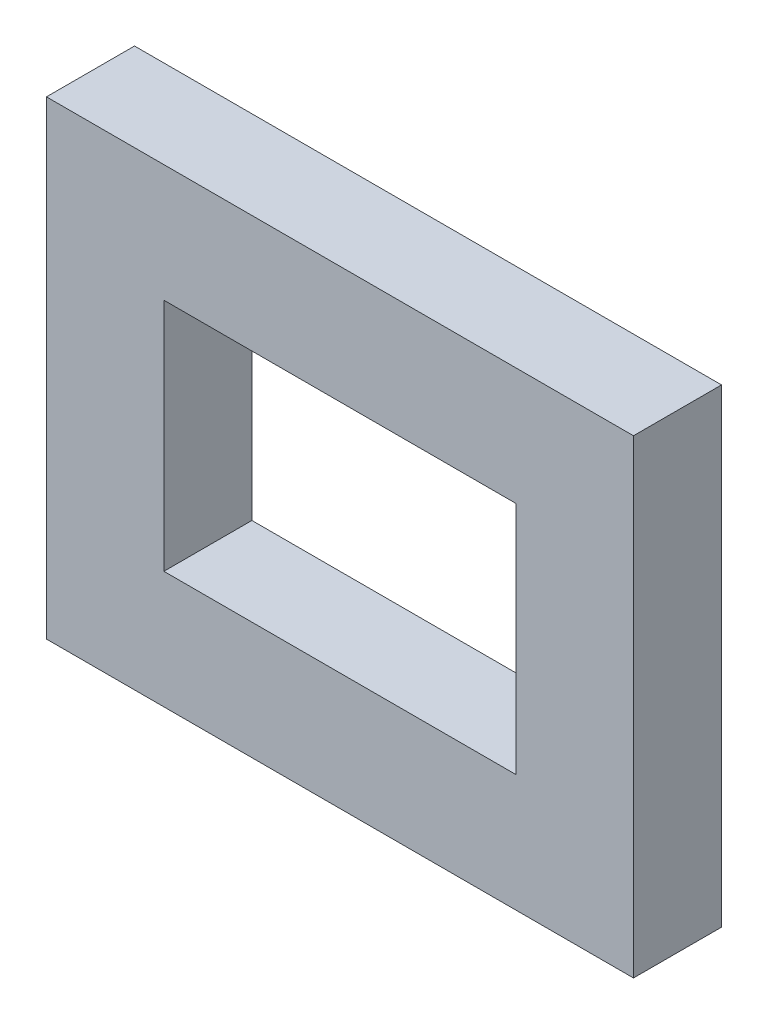
from build123d import *

# Parameters (mm, degrees)
SKETCH1_W     = 20
SKETCH1_H     = 16
SKETCH1_W_2   = 12
SKETCH1_H_2   = 8
PROFILE_DEPTH = 3


with BuildPart() as part:
    # Sketch1 → Profile (new body)
    with BuildSketch(Plane.XY):
        with Locations((10, 8)):
            Rectangle(SKETCH1_W, SKETCH1_H)
        with Locations((10, 8)):
            Rectangle(SKETCH1_W_2, SKETCH1_H_2, mode=Mode.SUBTRACT)
    extrude(amount=PROFILE_DEPTH)


solid = part.part
